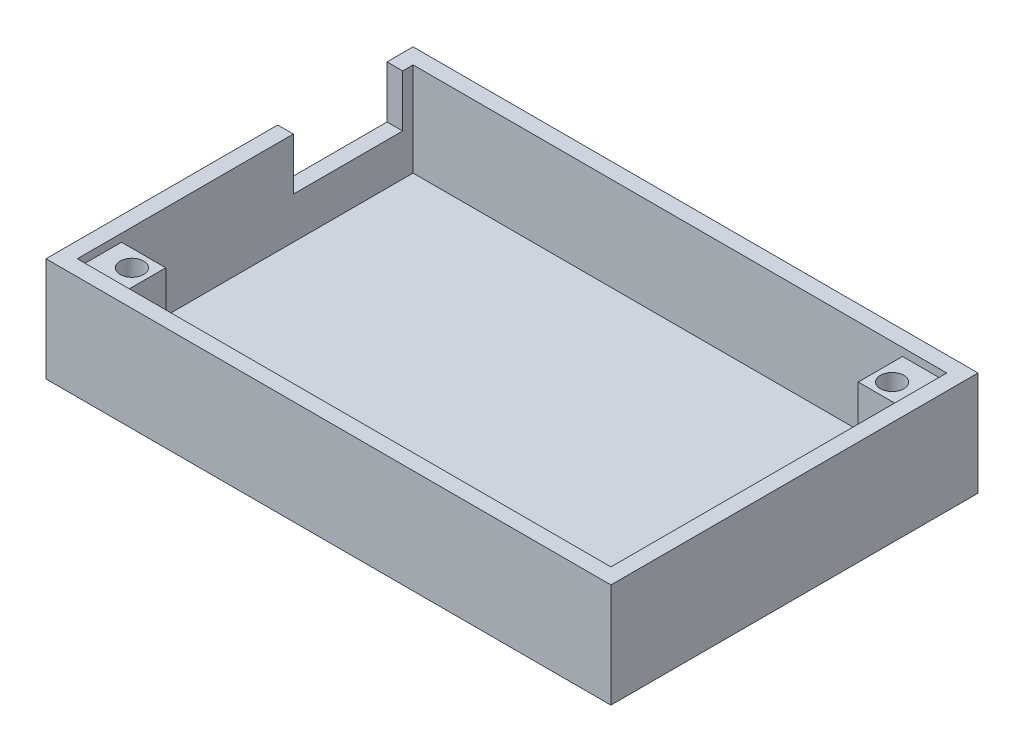
from build123d import *

# Parameters (mm, degrees)
SKETCH1_W               = 108.5
SKETCH1_H               = 70.5
BOSS_EXTRUDE1_DEPTH     = 20
SKETCH2_W               = 102.5
SKETCH2_H               = 64.5
CUT_EXTRUDE1_DEPTH      = 18
SKETCH3_W               = 8.5
SKETCH3_H               = 8.5
BOSS_EXTRUDE2_DEPTH     = 16.5
SKETCH4_R               = 2.25
CUT_EXTRUDE2_DEPTH      = 15
SKETCH7_W               = 21
SKETCH7_H               = 10
CUT_EXTRUDE5_DEPTH      = 8
SKETCH8_W               = 8.5
SKETCH8_H               = 8.5
BOSS_EXTRUDE3_DEPTH     = 16.5
CUT_EXTRUDE6_DEPTH      = 13
CUT_EXTRUDE6_DEPTH_BACK = 15
SKETCH9_R               = 2.25


with BuildPart() as part:
    # Sketch1 → Boss-Extrude1 (new body)
    with BuildSketch(Plane(origin=(0, 0, 0), x_dir=(1, 0, 0), z_dir=(0, 1, 0))):
        Rectangle(SKETCH1_W, SKETCH1_H)
    extrude(amount=BOSS_EXTRUDE1_DEPTH)

    # Sketch2 → Cut-Extrude1 (cut)
    with BuildSketch(Plane(origin=(0, 20, 0), x_dir=(1, 0, 0), z_dir=(0, 1, 0))):
        Rectangle(SKETCH2_W, SKETCH2_H)
    extrude(amount=-CUT_EXTRUDE1_DEPTH, mode=Mode.SUBTRACT)

    # Sketch3 → Boss-Extrude2 (add)
    with BuildSketch(Plane(origin=(0, 2, 0), x_dir=(1, 0, 0), z_dir=(0, 1, 0))):
        with Locations((-47, -28)):
            Rectangle(SKETCH3_W, SKETCH3_H)
    extrude(amount=BOSS_EXTRUDE2_DEPTH)

    # Sketch4 → Cut-Extrude2 (cut)
    with BuildSketch(Plane(origin=(0, 18.5, 0), x_dir=(1, 0, 0), z_dir=(0, 1, 0))):
        with Locations(Location((-46, -27, 0), (0, 0, 270))):
            Circle(SKETCH4_R)
    extrude(amount=-CUT_EXTRUDE2_DEPTH, mode=Mode.SUBTRACT)

    # Sketch7 → Cut-Extrude5 (cut)
    with BuildSketch(Plane(origin=(-51.25, 0, 0), x_dir=(0, 0, -1), z_dir=(1, 0, 0))):
        with Locations((19.75, 15)):
            Rectangle(SKETCH7_W, SKETCH7_H)
    extrude(amount=-CUT_EXTRUDE5_DEPTH, mode=Mode.SUBTRACT)

    # Sketch8 → Boss-Extrude3 (add)
    with BuildSketch(Plane(origin=(0, 2, 0), x_dir=(1, 0, 0), z_dir=(0, 1, 0))):
        with Locations((47, 28)):
            Rectangle(SKETCH8_W, SKETCH8_H)
    extrude(amount=BOSS_EXTRUDE3_DEPTH)

    # Sketch9 → Cut-Extrude6 (cut, two sides: drawn at the far end of the back side and taken through both)
    with BuildSketch(Plane(origin=(0, 18.5, 0), x_dir=(1, 0, 0), z_dir=(0, 1, 0)).offset(-CUT_EXTRUDE6_DEPTH_BACK)):
        with Locations(Location((46, 27, 0), (0, 0, 90))):
            Circle(SKETCH9_R)
    extrude(amount=CUT_EXTRUDE6_DEPTH + CUT_EXTRUDE6_DEPTH_BACK, mode=Mode.SUBTRACT)


solid = part.part
